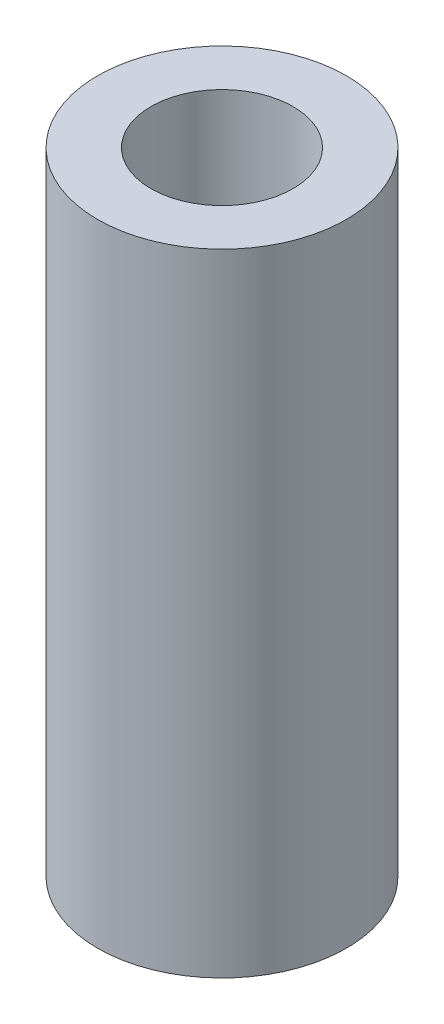
from build123d import *

# Parameters (mm, degrees)
SKETCH_1_W          = 14
SKETCH_1_H          = 71
SKETCH_2_R          = 8
CUT_EXTRUDE_1_DEPTH = 74.708886845


with BuildPart() as part:
    # 草图1 → 旋转1 (revolve)
    with BuildSketch(Plane.XY, mode=Mode.PRIVATE) as revolve_1_sk:
        with Locations((7, 35.5)):
            Rectangle(SKETCH_1_W, SKETCH_1_H)
    revolve(revolve_1_sk.sketch.rotate(Axis((0, 0, 0), (0, 1, 0)), 90), axis=Axis((0, 0, 0), (0, 1, 0)))

    # 草图2 → 切除-拉伸1 (cut, through all)
    with BuildSketch(Plane(origin=(0, 71, 0), x_dir=(1, 0, 0), z_dir=(0, 1, 0))):
        with Locations(Location((0, 0, 0), (0, 0, 270))):
            Circle(SKETCH_2_R)
    extrude(amount=-CUT_EXTRUDE_1_DEPTH, mode=Mode.SUBTRACT)


solid = part.part
